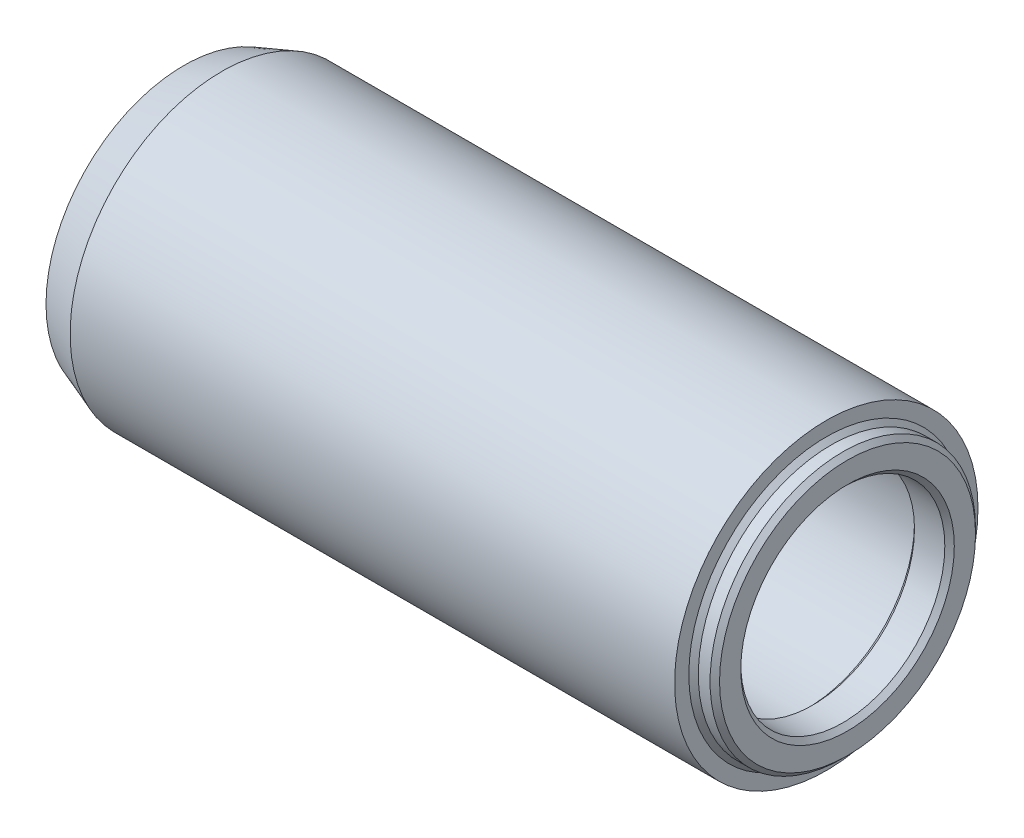
from build123d import *

# Parameters (mm, degrees)
CHAFL_N10_SIZE = 0.25
FILLET1_R      = 0.25


with BuildPart() as part:
    # Sketch1 → Revolve1 (revolve)
    with BuildSketch(Plane.XY, mode=Mode.PRIVATE) as revolve1_sk:
        Polygon((-33.87745169, 7.272059531), (-31.87745169, 8), (0, 8), (0, 7), (1.119965147, 7), (1.119965147, 5.380453235), (0, 5.380453235), (-0.979823496, 5.380453235), (-0.979823496, 6), (-33.87745169, 6), align=None)
    revolve(revolve1_sk.sketch.rotate(Axis((0, 0, 0), (-1, 0, 0)), 90), axis=Axis((0, 0, 0), (-1, 0, 0)))

    # Chaflán10
    chafl_n10_edges = [part.edges().sort_by_distance(p)[0] for p in [
        (-33.87745169, 0, 6),
        (-0.979823496, 0, 5.380453235),
        (1.119965147, 0, 5.380453235),
        (1.119965147, 0, 7),
        (0, 0, 7),
    ]]
    chamfer(chafl_n10_edges, length=CHAFL_N10_SIZE)

    # Fillet1
    fillet1_edges = [part.edges().sort_by_distance(p)[0] for p in [
        (-0.979823496, 0, 6),
    ]]
    fillet(fillet1_edges, radius=FILLET1_R)


solid = part.part
